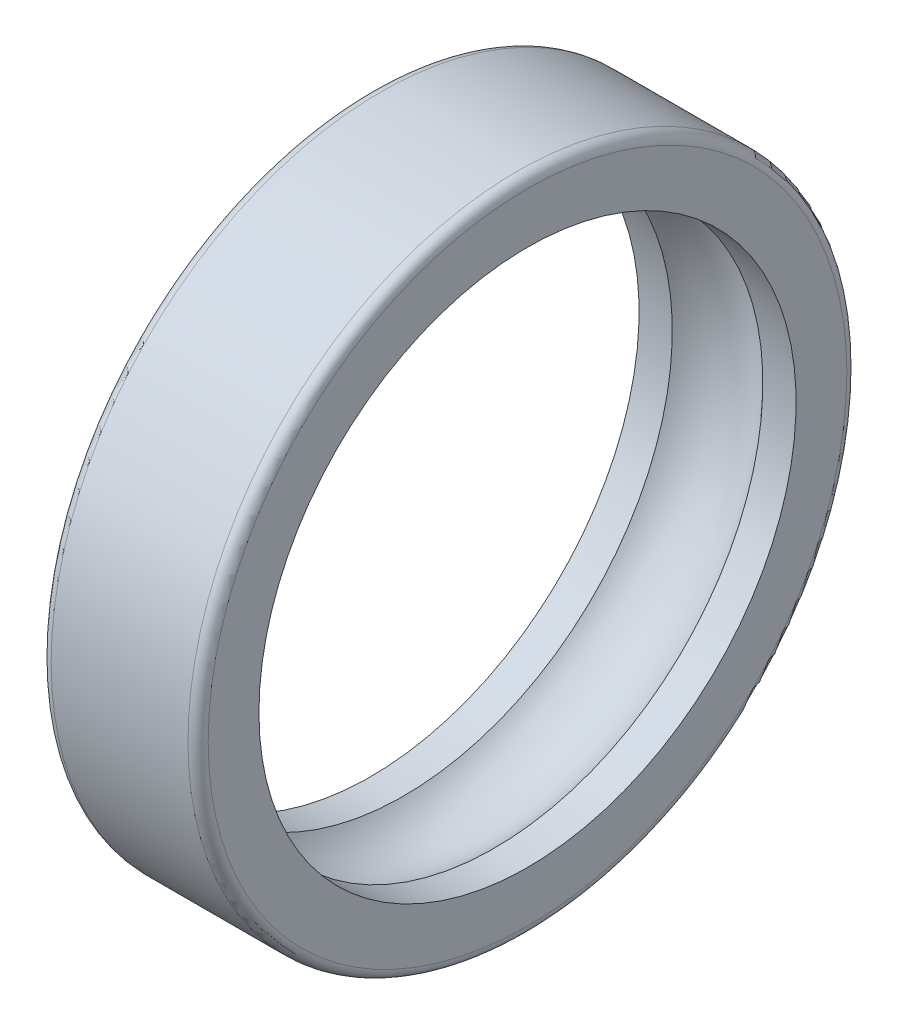
from build123d import *

# Parameters (mm, degrees)
FILLET_1_R = 0.46


with BuildPart() as part:
    # 草图1 → 旋转1 (revolve)
    with BuildSketch(Plane.XY, mode=Mode.PRIVATE) as revolve_1_sk:
        with BuildLine():
            Line((2.061649825, 12.23), (3.575, 12.23))
            Line((3.575, 12.23), (3.575, 15))
            Line((3.575, 15), (-3.575, 15))
            Line((-3.575, 15), (-3.575, 12.23))
            Line((-3.575, 12.23), (-2.061649825, 12.23))
            ThreePointArc((-2.061649825, 12.23), (0, 13.15), (2.061649825, 12.23))
        make_face()
    revolve(revolve_1_sk.sketch.rotate(Axis((0, 0, 0), (1, 0, 0)), 90), axis=Axis((0, 0, 0), (1, 0, 0)))

    # 圆角1
    fillet_1_edges = [part.edges().sort_by_distance(p)[0] for p in [
        (3.575, 0, -15),
        (-3.575, 0, -15),
    ]]
    fillet(fillet_1_edges, radius=FILLET_1_R)


solid = part.part
